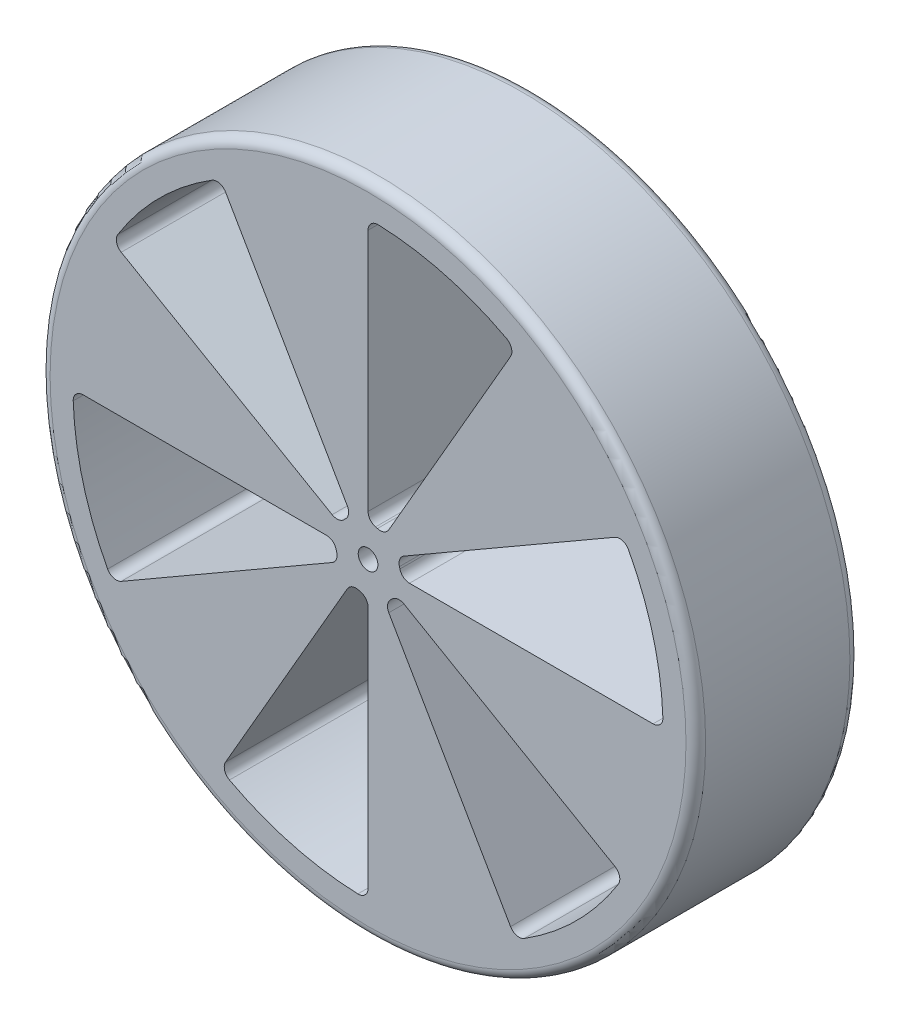
from build123d import *

# Parameters (mm, degrees)
SKETCH1_R           = 100
BOSS_EXTRUDE1_DEPTH = 50
CUT_EXTRUDE1_DEPTH  = 151
CIRPATTERN1_COUNT   = 6
FILLET1_R           = 3
SKETCH3_R           = 3
CUT_EXTRUDE2_DEPTH  = 151.000000067


with BuildPart() as part:
    # Sketch1 → Boss-Extrude1 (new body)
    with BuildSketch(Plane.XY):
        Circle(SKETCH1_R)
    extrude(amount=BOSS_EXTRUDE1_DEPTH)

    # Sketch2 → Cut-Extrude1 (cut, through all)
    with BuildSketch(Plane.XY.offset(50)):
        with BuildLine():
            Line((0, 90), (0, 10))
            ThreePointArc((0, 10), (2.588190451, 9.659258263), (5, 8.660254038))
            Line((5, 8.660254038), (45, 77.942286341))
            ThreePointArc((45, 77.942286341), (23.293714059, 86.933324366), (0, 90))
        make_face()
    cut_extrude1 = extrude(amount=-CUT_EXTRUDE1_DEPTH, mode=Mode.SUBTRACT)

    # CirPattern1: Cut-Extrude1 ×6 about axis
    cirpattern1_axis = Axis((0, 0, 0), (0, 0, 1))
    for i in range(1, CIRPATTERN1_COUNT):
        add(cut_extrude1.rotate(cirpattern1_axis, i * 360 / CIRPATTERN1_COUNT), mode=Mode.SUBTRACT)

    # Fillet1
    fillet1_edges = [part.edges().sort_by_distance(p)[0] for p in [
        (45, 77.942286341, 25),
        (5, 8.660254038, 25),
        (0, 10, 25),
        (0, 90, 25),
        (-100, 0, 0),
        (90, 0, 25),
        (10, 0, 25),
        (8.660254038, 5, 25),
        (77.942286341, 45, 25),
        (45, -77.942286341, 25),
        (5, -8.660254038, 25),
        (8.660254038, -5, 25),
        (-100, 0, 50),
        (77.942286341, -45, 25),
        (-90, 0, 25),
        (-10, 0, 25),
        (-8.660254038, -5, 25),
        (-77.942286341, -45, 25),
        (-45, -77.942286341, 25),
        (-5, -8.660254038, 25),
        (0, -10, 25),
        (0, -90, 25),
        (-45, 77.942286341, 25),
        (-5, 8.660254038, 25),
        (-8.660254038, 5, 25),
        (-77.942286341, 45, 25),
    ]]
    fillet(fillet1_edges, radius=FILLET1_R)

    # Sketch3 → Cut-Extrude2 (cut, through all)
    with BuildSketch(Plane.XY.offset(50)):
        Circle(SKETCH3_R)
    extrude(amount=-CUT_EXTRUDE2_DEPTH, mode=Mode.SUBTRACT)


solid = part.part
